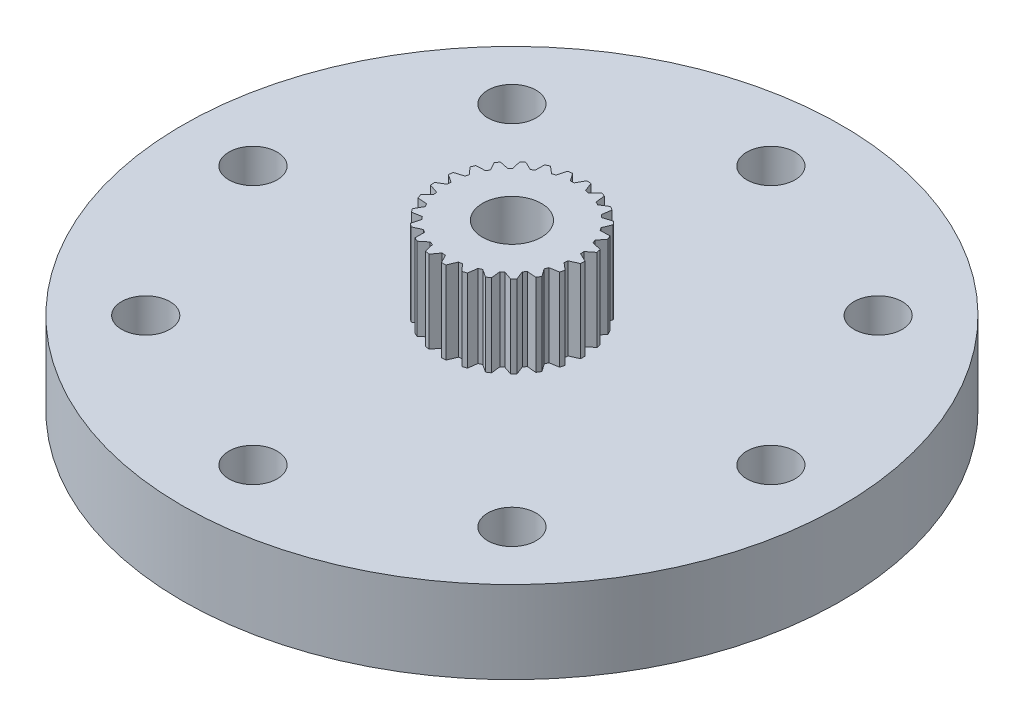
from build123d import *

# Parameters (mm, degrees)
SKETCH1_R                          = 14
BOSS_EXTRUDE1_DEPTH                = 1.75
TAP_DRILL_FOR_M2_5X0_45_TAP1_D     = 2.05
TAP_DRILL_FOR_M2_5X0_45_TAP1_DEPTH = 6
TAP_DRILL_FOR_M2_5X0_45_TAP1_TIP   = 0.615882135
SKETCH7_R                          = 5
CUT_EXTRUDE1_DEPTH                 = 2.3
BOSS_EXTRUDE3_DEPTH                = 3.5
TAP_DRILL_FOR_M3X0_5_TAP1_D        = 2.5
TAP_DRILL_FOR_M3X0_5_TAP1_DEPTH    = 6
TAP_DRILL_FOR_M3X0_5_TAP1_TIP      = 0.751075774


with BuildPart() as part:
    # Sketch1 → Boss-Extrude1 (new, symmetric)
    with BuildSketch(Plane(origin=(0, 0, 0), x_dir=(1, 0, 0), z_dir=(0, 1, 0))):
        with Locations(Location((0, 0, 0), (0, 0, 270))):
            Circle(SKETCH1_R)
    extrude(amount=BOSS_EXTRUDE1_DEPTH, both=True)

    # Tap Drill for M2.5x0.45 Tap1
    with Locations(Plane(origin=(0, 1.75, 0), x_dir=(1, 0, 0), z_dir=(0, 1, 0))):
        with Locations((-11, 0), (-7.778174593, 7.778174593), (0, 11), (7.778174593, 7.778174593), (11, 0), (7.778174593, -7.778174593), (0, -11), (-7.778174593, -7.778174593)):
            Hole(TAP_DRILL_FOR_M2_5X0_45_TAP1_D / 2, depth=TAP_DRILL_FOR_M2_5X0_45_TAP1_DEPTH)
            with Locations((0, 0, -(TAP_DRILL_FOR_M2_5X0_45_TAP1_DEPTH + TAP_DRILL_FOR_M2_5X0_45_TAP1_TIP / 2))):  # 118° drill point
                Cone(0, TAP_DRILL_FOR_M2_5X0_45_TAP1_D / 2, TAP_DRILL_FOR_M2_5X0_45_TAP1_TIP, mode=Mode.SUBTRACT)

    # Sketch7 → Cut-Extrude1 (cut)
    with BuildSketch(Plane.XZ.offset(1.75)):
        with Locations(Location((0, 0, 0), (0, 0, 270))):
            Circle(SKETCH7_R)
    extrude(amount=-CUT_EXTRUDE1_DEPTH, mode=Mode.SUBTRACT)

    # Sketch8 → Boss-Extrude3 (add)
    with BuildSketch(Plane(origin=(0, 1.75, 0), x_dir=(1, 0, 0), z_dir=(0, 1, 0))):
        with BuildLine():
            Line((-0.128852443, -2.696923627), (0.057352661, -3.049460718))
            ThreePointArc((0.057352661, -3.049460718), (0.151245078, -3.04624768), (0.244993995, -3.040144395))
            Line((0.244993995, -3.040144395), (0.395362741, -2.670896535))
            ThreePointArc((0.395362741, -2.670896535), (0.470816738, -2.658633408), (0.545893326, -2.644239111))
            Line((0.545893326, -2.644239111), (0.813920864, -2.939393275))
            ThreePointArc((0.813920864, -2.939393275), (0.904064427, -2.912931086), (0.993350224, -2.883705139))
            Line((0.993350224, -2.883705139), (1.047166652, -2.488662694))
            ThreePointArc((1.047166652, -2.488662694), (1.117200406, -2.458020189), (1.18633861, -2.425407327))
            Line((1.18633861, -2.425407327), (1.519347425, -2.644632943))
            ThreePointArc((1.519347425, -2.644632943), (1.600078084, -2.596584319), (1.679290606, -2.546072084))
            Line((1.679290606, -2.546072084), (1.63317323, -2.150057022))
            ThreePointArc((1.63317323, -2.150057022), (1.693386265, -2.102960522), (1.752241875, -2.054178281))
            Line((1.752241875, -2.054178281), (2.1293078, -2.183700596))
            ThreePointArc((2.1293078, -2.183700596), (2.19555295, -2.11708461), (2.259714983, -2.048459957))
            Line((2.259714983, -2.048459957), (2.116561528, -1.676355361))
            ThreePointArc((2.116561528, -1.676355361), (2.163170436, -1.615764111), (2.208045339, -1.553877659))
            Line((2.208045339, -1.553877659), (2.605475935, -1.58555831))
            ThreePointArc((2.605475935, -1.58555831), (2.653073149, -1.504560688), (2.698153157, -1.422135556))
            Line((2.698153157, -1.422135556), (2.466958481, -1.097322127))
            ThreePointArc((2.466958481, -1.097322127), (2.497034654, -1.027043299), (2.525109194, -0.955941189))
            Line((2.525109194, -0.955941189), (2.917932434, -0.887789563))
            ThreePointArc((2.917932434, -0.887789563), (2.943891005, -0.797499685), (2.967056445, -0.706453148))
            Line((2.967056445, -0.706453148), (2.66234736, -0.449340108))
            ThreePointArc((2.66234736, -0.449340108), (2.674001, -0.373789578), (2.683511152, -0.297939418))
            Line((2.683511152, -0.297939418), (3.047044507, -0.134237734))
            ThreePointArc((3.047044507, -0.134237734), (3.049733363, -0.040328844), (3.049528665, 0.053618309))
            Line((3.049528665, 0.053618309), (2.690451163, 0.226875602))
            ThreePointArc((2.690451163, 0.226875602), (2.68295003, 0.302950716), (2.673298235, 0.378782983))
            Line((2.673298235, 0.378782983), (2.984699568, 0.627748746))
            ThreePointArc((2.984699568, 0.627748746), (2.963949757, 0.719376006), (2.940387783, 0.810320731))
            Line((2.940387783, 0.810320731), (2.549504025, 0.888835884))
            ThreePointArc((2.549504025, 0.888835884), (2.523319442, 0.960655502), (2.495112158, 1.031705055))
            Line((2.495112158, 1.031705055), (2.734814978, 1.350291464))
            ThreePointArc((2.734814978, 1.350291464), (2.691930287, 1.433879817), (2.646491522, 1.516107721))
            Line((2.646491522, 1.516107721), (2.248362172, 1.494947338))
            ThreePointArc((2.248362172, 1.494947338), (2.205139413, 1.55799877), (2.160149007, 1.619801305))
            Line((2.160149007, 1.619801305), (2.313091905, 1.987990402))
            ThreePointArc((2.313091905, 1.987990402), (2.250766937, 2.058287685), (2.186306467, 2.126632087))
            Line((2.186306467, 2.126632087), (1.805947455, 2.007125753))
            ThreePointArc((1.805947455, 2.007125753), (1.748402365, 2.057447246), (1.68945575, 2.106119481))
            Line((1.68945575, 2.106119481), (1.74602876, 2.500776593))
            ThreePointArc((1.74602876, 2.500776593), (1.668179623, 2.553365768), (1.588747735, 2.603532338))
            Line((1.588747735, 2.603532338), (1.250058417, 2.393189076))
            ThreePointArc((1.250058417, 2.393189076), (1.181806766, 2.427618744), (1.112607775, 2.460102424))
            Line((1.112607775, 2.460102424), (1.069256207, 2.856429793))
            ThreePointArc((1.069256207, 2.856429793), (0.980774447, 2.888006489), (0.89136214, 2.916843077))
            Line((0.89136214, 2.916843077), (0.615623612, 2.628879527))
            ThreePointArc((0.615623612, 2.628879527), (0.540953902, 2.645254028), (0.465850562, 2.659508085))
            Line((0.465850562, 2.659508085), (0.325298354, 3.032603004))
            ThreePointArc((0.325298354, 3.032603004), (0.231743607, 3.041183141), (0.137968984, 3.046877838))
            Line((0.137968984, 3.046877838), (-0.057493089, 2.699387809))
            ThreePointArc((-0.057493089, 2.699387809), (-0.133889085, 2.696678274), (-0.210177756, 2.691807071))
            Line((-0.210177756, 2.691807071), (-0.439099191, 3.018226615))
            ThreePointArc((-0.439099191, 3.018226615), (-0.531848537, 3.003271072), (-0.624093271, 2.985466059))
            Line((-0.624093271, 2.985466059), (-0.726997287, 2.600283627))
            ThreePointArc((-0.726997287, 2.600283627), (-0.800319329, 2.578660305), (-0.872999832, 2.55496992))
            Line((-0.872999832, 2.55496992), (-1.175906519, 2.814203948))
            ThreePointArc((-1.175906519, 2.814203948), (-1.262022681, 2.776652436), (-1.346941451, 2.736466467))
            Line((-1.346941451, 2.736466467), (-1.350821572, 2.337794062))
            ThreePointArc((-1.350821572, 2.337794062), (-1.416462566, 2.298615626), (-1.480968118, 2.257594612))
            Line((-1.480968118, 2.257594612), (-1.838827315, 2.433354496))
            ThreePointArc((-1.838827315, 2.433354496), (-1.912899299, 2.375566516), (-1.985156345, 2.315524624))
            Line((-1.985156345, 2.315524624), (-1.88976877, 1.928412299))
            ThreePointArc((-1.88976877, 1.928412299), (-1.943604251, 1.874140474), (-1.995881731, 1.818366332))
            Line((-1.995881731, 1.818366332), (-2.386207829, 1.899608433))
            ThreePointArc((-2.386207829, 1.899608433), (-2.443581419, 1.825215014), (-2.498636566, 1.749089852))
            Line((-2.498636566, 1.749089852), (-2.309974846, 1.397861298))
            ThreePointArc((-2.309974846, 1.397861298), (-2.348622132, 1.331906183), (-2.385386754, 1.264883407))
            Line((-2.385386754, 1.264883407), (-2.783654129, 1.246502985))
            ThreePointArc((-2.783654129, 1.246502985), (-2.820724331, 1.160178541), (-2.855118261, 1.072753333))
            Line((-2.855118261, 1.072753333), (-2.585036707, 0.779477531))
            ThreePointArc((-2.585036707, 0.779477531), (-2.606067447, 0.705983328), (-2.625009154, 0.631923206))
            Line((-2.625009154, 0.631923206), (-3.006193202, 0.51507517))
            ThreePointArc((-3.006193202, 0.51507517), (-3.02063076, 0.422243783), (-3.032202376, 0.329011776))
            Line((-3.032202376, 0.329011776), (-2.697671205, 0.112116324))
            ThreePointArc((-2.697671205, 0.112116324), (-2.69976396, 0.035700944), (-2.699692576, -0.040743054))
            Line((-2.699692576, -0.040743054), (-3.0398421, -0.248716711))
            ThreePointArc((-3.0398421, -0.248716711), (-3.030739849, -0.342222105), (-3.018762064, -0.435402801))
            Line((-3.018762064, -0.435402801), (-2.640801099, -0.562289564))
            ThreePointArc((-2.640801099, -0.562289564), (-2.623824375, -0.636824661), (-2.604744383, -0.710849278))
            Line((-2.604744383, -0.710849278), (-2.88248654, -0.996880808))
            ThreePointArc((-2.88248654, -0.996880808), (-2.850416406, -1.085184919), (-2.815641829, -1.172459418))
            Line((-2.815641829, -1.172459418), (-2.417999748, -1.201364731))
            ThreePointArc((-2.417999748, -1.201364731), (-2.383020254, -1.269336231), (-2.346130522, -1.336290227))
            Line((-2.346130522, -1.336290227), (-2.544013749, -1.682407216))
            ThreePointArc((-2.544013749, -1.682407216), (-2.490990819, -1.759961574), (-2.435604463, -1.835846099))
            Line((-2.435604463, -1.835846099), (-2.04326658, -1.764953733))
            ThreePointArc((-2.04326658, -1.764953733), (-1.992482207, -1.822090738), (-1.940100652, -1.877767147))
            Line((-1.940100652, -1.877767147), (-2.045691219, -2.262221792))
            ThreePointArc((-2.045691219, -2.262221792), (-1.975047116, -2.32415337), (-1.902529111, -2.383879817))
            Line((-1.902529111, -2.383879817), (-1.540147459, -2.217644202))
            ThreePointArc((-1.540147459, -2.217644202), (-1.476749174, -2.260356582), (-1.412167122, -2.301257052))
            Line((-1.412167122, -2.301257052), (-1.418830385, -2.699892653))
            ThreePointArc((-1.418830385, -2.699892653), (-1.33500394, -2.742310063), (-1.249910858, -2.782125599))
            Line((-1.249910858, -2.782125599), (-0.940255208, -2.530991929))
            ThreePointArc((-0.940255208, -2.530991929), (-0.86822656, -2.556595909), (-0.795501939, -2.580150512))
            Line((-0.795501939, -2.580150512), (-0.70281922, -2.967919329))
            ThreePointArc((-0.70281922, -2.967919329), (-0.611077556, -2.988157329), (-0.518756109, -3.005560197))
            Line((-0.518756109, -3.005560197), (-0.281283264, -2.685308125))
            ThreePointArc((-0.281283264, -2.685308125), (-0.205150078, -2.692194912), (-0.128852443, -2.696923627))
        make_face()
    extrude(amount=BOSS_EXTRUDE3_DEPTH)

    # Tap Drill for M3x0.5 Tap1
    with Locations(Plane(origin=(0, 5.25, 0), x_dir=(1, 0, 0), z_dir=(0, 1, 0))):
        with Locations((0, 0)):
            Hole(TAP_DRILL_FOR_M3X0_5_TAP1_D / 2, depth=TAP_DRILL_FOR_M3X0_5_TAP1_DEPTH)
            with Locations((0, 0, -(TAP_DRILL_FOR_M3X0_5_TAP1_DEPTH + TAP_DRILL_FOR_M3X0_5_TAP1_TIP / 2))):  # 118° drill point
                Cone(0, TAP_DRILL_FOR_M3X0_5_TAP1_D / 2, TAP_DRILL_FOR_M3X0_5_TAP1_TIP, mode=Mode.SUBTRACT)


solid = part.part
